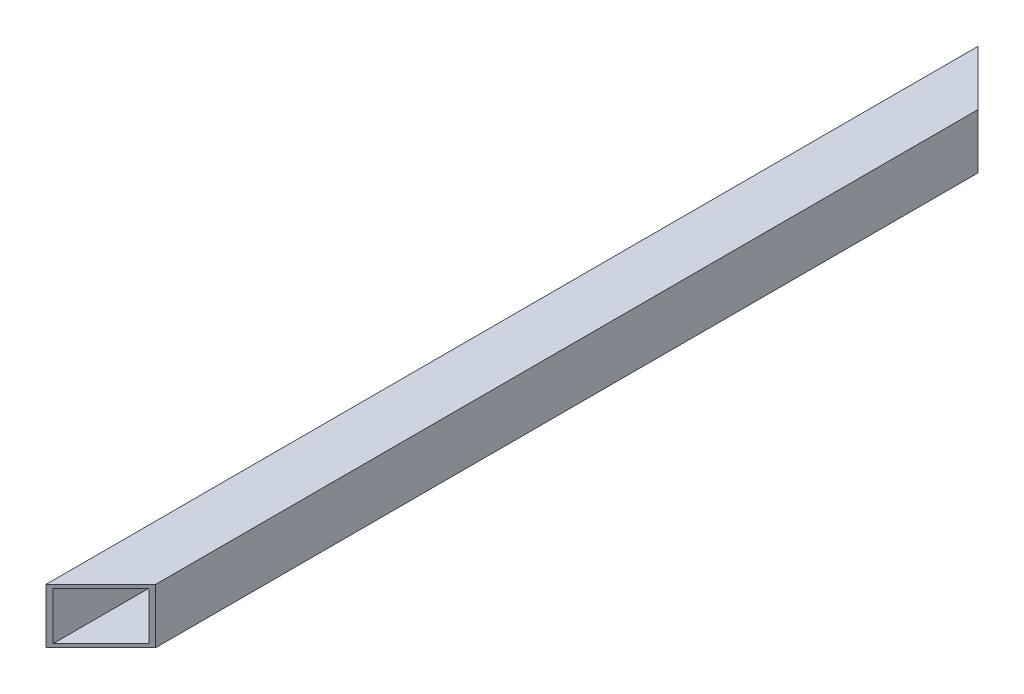
from build123d import *

# Parameters (mm, degrees)
SKETCH1_W           = 25.4
SKETCH1_H           = 25.4
SKETCH1_W_2         = 22.225
SKETCH1_H_2         = 22.225
BOSS_EXTRUDE1_DEPTH = 431.8
CUT_EXTRUDE1_DEPTH  = 433.73281595


with BuildPart() as part:
    # Sketch1 → Boss-Extrude1 (new body)
    with BuildSketch(Plane.XY):
        Rectangle(SKETCH1_W, SKETCH1_H)
        Rectangle(SKETCH1_W_2, SKETCH1_H_2, mode=Mode.SUBTRACT)
    extrude(amount=BOSS_EXTRUDE1_DEPTH)

    # Sketch2 → Cut-Extrude1 (cut, through all)
    with BuildSketch(Plane(origin=(0, 12.7, 0), x_dir=(1, 0, 0), z_dir=(0, 1, 0))):
        Polygon((12.7, 0), (12.7, -25.4), (-12.7, 0), align=None)
    cut_extrude1 = extrude(amount=-CUT_EXTRUDE1_DEPTH, mode=Mode.SUBTRACT)

    # Mirror1: Cut-Extrude1 across plane
    add(cut_extrude1.mirror(Plane.XY.offset(215.9)), mode=Mode.SUBTRACT)


solid = part.part
